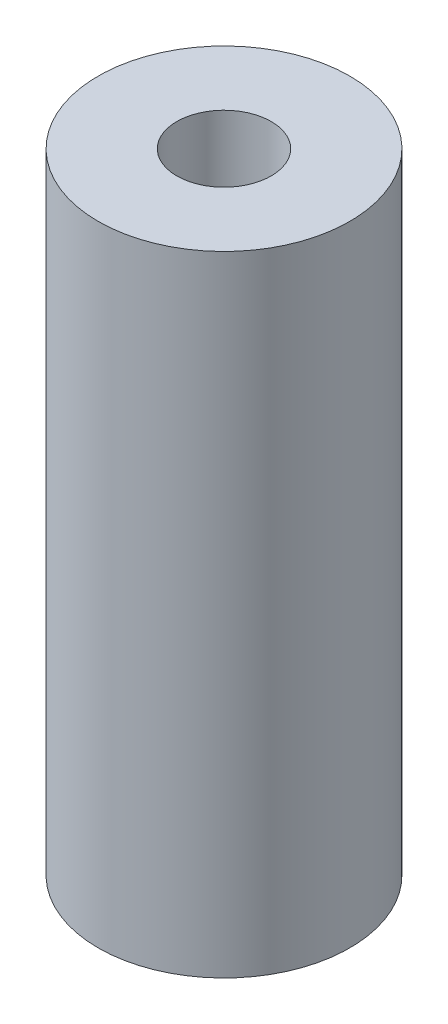
from build123d import *

# Parameters (mm, degrees)
SKETCH1_R           = 4
BOSS_EXTRUDE1_DEPTH = 20
SKETCH2_R           = 1.5
CUT_EXTRUDE1_DEPTH  = 15


with BuildPart() as part:
    # Sketch1 → Boss-Extrude1 (new body)
    with BuildSketch(Plane(origin=(0, 0, 0), x_dir=(1, 0, 0), z_dir=(0, 1, 0))):
        with Locations(Location((0, 0, 0), (0, 0, 270))):
            Circle(SKETCH1_R)
    extrude(amount=BOSS_EXTRUDE1_DEPTH)

    # Sketch2 → Cut-Extrude1 (cut)
    with BuildSketch(Plane(origin=(0, 20, 0), x_dir=(1, 0, 0), z_dir=(0, 1, 0))):
        with Locations(Location((0, 0, 0), (0, 0, 270))):
            Circle(SKETCH2_R)
    extrude(amount=-CUT_EXTRUDE1_DEPTH, mode=Mode.SUBTRACT)


solid = part.part
